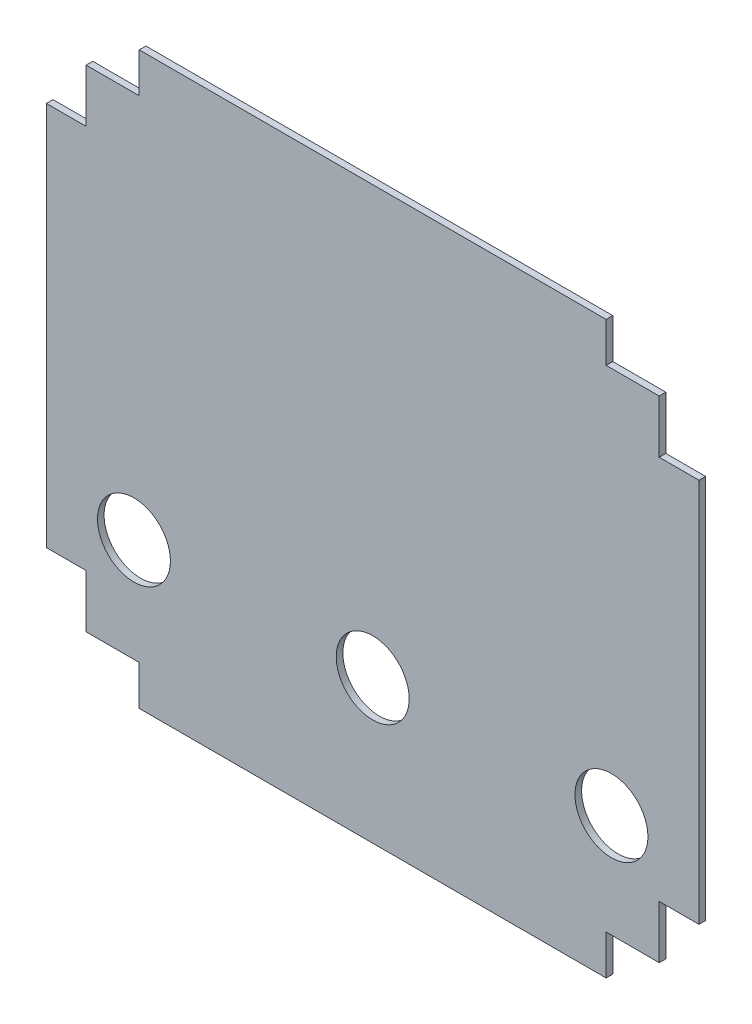
from build123d import *

# Parameters (mm, degrees)
SALIENTE_EXTRUIR1_DEPTH = 5
CROQUIS2_R              = 27.5
CORTAR_EXTRUIR1_DEPTH   = 10


with BuildPart() as part:
    # Croquis1 → Saliente-Extruir1 (new body)
    with BuildSketch(Plane.XY):
        Polygon((0, 215), (0, 0), (246, 0), (246, 145), (216, 145), (216, 185), (176, 185), (176, 215), align=None)
        Polygon((-246, 145), (-246, 0), (0, 0), (0, 215), (-176, 215), (-176, 185), (-216, 185), (-216, 145), align=None)
        Polygon((0, 0), (-246, 0), (-246, -145), (-216, -145), (-216, -185), (-176, -185), (-176, -215), (176, -215), (176, -185), (216, -185), (216, -145), (246, -145), (246, 0), align=None)
    extrude(amount=SALIENTE_EXTRUIR1_DEPTH)

    # Croquis2 → Cortar-Extruir1 (cut)
    with BuildSketch(Plane.XY.offset(5)):
        with Locations((-180, -107)):
            Circle(CROQUIS2_R)
        with Locations((0, -107)):
            Circle(CROQUIS2_R)
        with Locations((180, -107)):
            Circle(CROQUIS2_R)
    extrude(amount=-CORTAR_EXTRUIR1_DEPTH, mode=Mode.SUBTRACT)


solid = part.part
